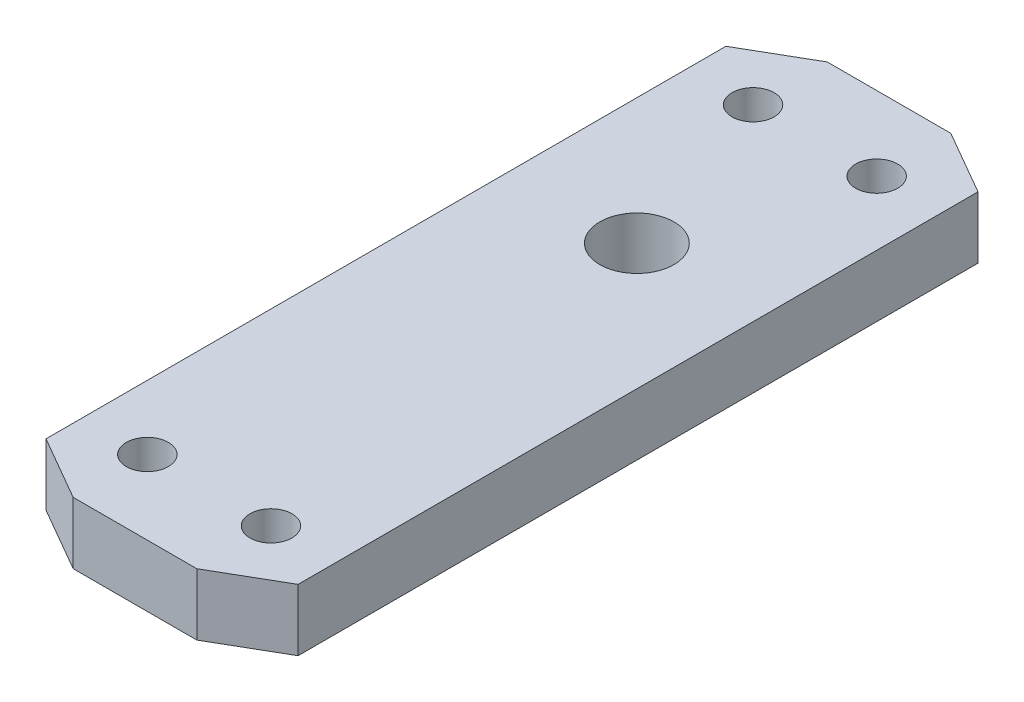
from build123d import *

# Parameters (mm, degrees)
SKETCH_1_R      = 1.7
SKETCH_1_R_2    = 3
EXTRUDE_1_DEPTH = 5


with BuildPart() as part:
    # 草图1 → 凸台-拉伸1 (new body)
    with BuildSketch(Plane(origin=(0, 0, 0), x_dir=(1, 0, 0), z_dir=(0, 1, 0))):
        Polygon((2730.385541969, 1310.349727583), (2740.385541969, 1310.349727583), (2745.581694392, 1307.349727583), (2745.581694392, 1252.349727583), (2740.385541969, 1249.349727583), (2730.385541969, 1249.349727583), (2725.189389547, 1252.349727583), (2725.189389547, 1307.349727583), align=None)
        with Locations(Location((2740.385541969, 1255.349727583, 0), (0, 0, 270))):
            Circle(SKETCH_1_R, mode=Mode.SUBTRACT)
        with Locations(Location((2730.385541969, 1255.349727583, 0), (0, 0, 270))):
            Circle(SKETCH_1_R, mode=Mode.SUBTRACT)
        with Locations(Location((2735.385541969, 1289.949727583, 0), (0, 0, 270))):
            Circle(SKETCH_1_R_2, mode=Mode.SUBTRACT)
        with Locations(Location((2730.385541969, 1304.349727583, 0), (0, 0, 270))):
            Circle(SKETCH_1_R, mode=Mode.SUBTRACT)
        with Locations(Location((2740.385541969, 1304.349727583, 0), (0, 0, 270))):
            Circle(SKETCH_1_R, mode=Mode.SUBTRACT)
    extrude(amount=EXTRUDE_1_DEPTH)


solid = part.part
